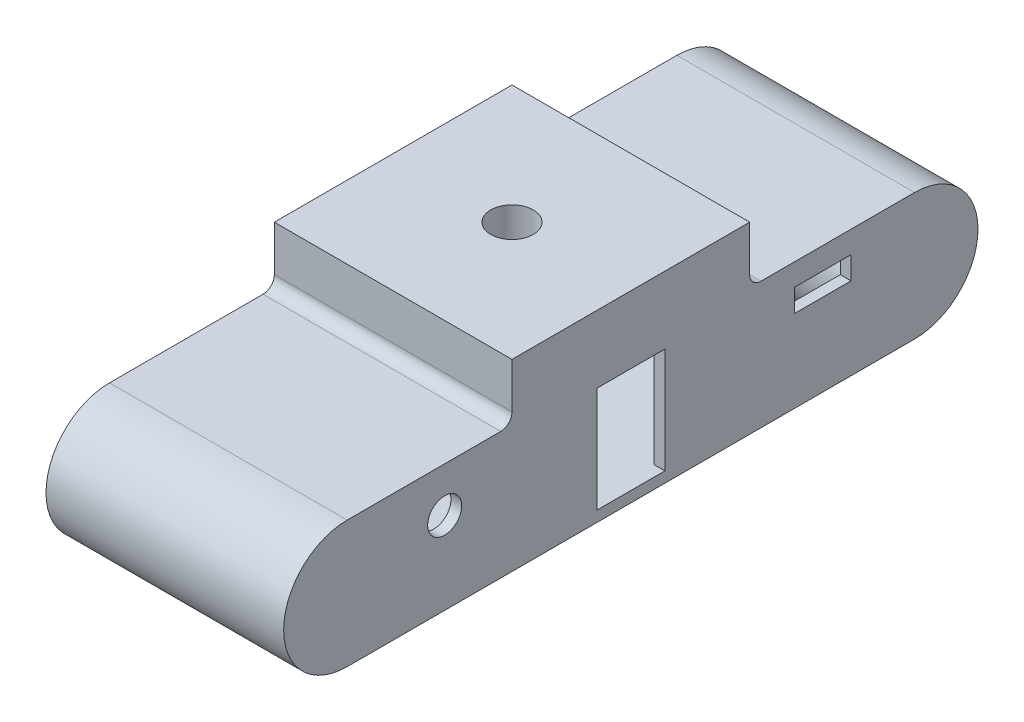
from build123d import *

# Parameters (mm, degrees)
SKETCH1_R               = 11.811
BOSS_EXTRUDE1_DEPTH     = 50.8
BOSS_EXTRUDE2_DEPTH     = 2.399999772
SKETCH5_R               = 3.81
SKETCH5_W               = 12.7
SKETCH5_H               = 5.08
SKETCH5_W_2             = 15.24
SKETCH5_H_2             = 23.622
CUT_EXTRUDE3_DEPTH      = 3.81
SKETCH8_W               = 53.199999772
SKETCH8_H               = 53.199999772
BOSS_EXTRUDE3_DEPTH     = 12.7
CUT_EXTRUDE5_DEPTH      = 99.371995605
CUT_EXTRUDE5_DEPTH_BACK = 3.81
SKETCH6_R               = 4.7625
FILLET1_R               = 2.54


with BuildPart() as part:
    # Sketch1 → Boss-Extrude1 (new body)
    with BuildSketch(Plane(origin=(0, 0, 0), x_dir=(0, 0, -1), z_dir=(1, 0, 0))):
        with BuildLine():
            Line((-63.5, 14.210999772), (63.5, 14.210999772))
            ThreePointArc((63.5, 14.210999772), (77.710999772, 0), (63.5, -14.210999772))
            Line((63.5, -14.210999772), (-63.5, -14.210999772))
            ThreePointArc((-63.5, -14.210999772), (-77.710999772, 0), (-63.5, 14.210999772))
        make_face()
        with Locations((-63.5, 0)):
            Circle(SKETCH1_R, mode=Mode.SUBTRACT)
        with Locations((63.5, 0)):
            Circle(SKETCH1_R, mode=Mode.SUBTRACT)
        with BuildLine():
            Line((-55.597292014, 11.811), (55.597292014, 11.811))
            ThreePointArc((55.597292014, 11.811), (49.289000228, 0), (55.597292014, -11.811))
            Line((55.597292014, -11.811), (-55.597292014, -11.811))
            ThreePointArc((-55.597292014, -11.811), (-49.289000228, 0), (-55.597292014, 11.811))
        make_face(mode=Mode.SUBTRACT)
    extrude(amount=BOSS_EXTRUDE1_DEPTH)

    # Sketch2 → Boss-Extrude2 (add)
    with BuildSketch(Plane(origin=(50.8, 0, 0), x_dir=(0, 0, -1), z_dir=(1, 0, 0))):
        with BuildLine():
            Line((-63.5, -14.210999772), (63.5, -14.210999772))
            ThreePointArc((63.5, -14.210999772), (77.710999772, 0), (63.5, 14.210999772))
            Line((63.5, 14.210999772), (-63.5, 14.210999772))
            ThreePointArc((-63.5, 14.210999772), (-77.710999772, 0), (-63.5, -14.210999772))
        make_face()
    extrude(amount=BOSS_EXTRUDE2_DEPTH)

    # Sketch5 → Cut-Extrude3 (cut)
    with BuildSketch(Plane.ZY.offset(-50.8)):
        with Locations((41.669000228, 4.191)):
            Circle(SKETCH5_R)
        with Locations((-42.939000228, 6.731)):
            Rectangle(SKETCH5_W, SKETCH5_H)
        Rectangle(SKETCH5_W_2, SKETCH5_H_2)
    extrude(amount=-CUT_EXTRUDE3_DEPTH, mode=Mode.SUBTRACT)

    # Sketch8 → Boss-Extrude3 (add)
    with BuildSketch(Plane(origin=(0, 14.210999772, 0), x_dir=(1, 0, 0), z_dir=(0, 1, 0))):
        with Locations((26.599999886, 0)):
            Rectangle(SKETCH8_W, SKETCH8_H)
    extrude(amount=BOSS_EXTRUDE3_DEPTH)

    # Sketch6 → Cut-Extrude5 (cut, two sides: drawn at the far end of the back side and taken through both)
    with BuildSketch(Plane(origin=(0, 14.210999772, 0), x_dir=(1, 0, 0), z_dir=(0, 1, 0)).offset(-CUT_EXTRUDE5_DEPTH_BACK)):
        with Locations(Location((26.599999886, 0, 0), (0, 0, 270))):
            Circle(SKETCH6_R)
    extrude(amount=CUT_EXTRUDE5_DEPTH + CUT_EXTRUDE5_DEPTH_BACK, mode=Mode.SUBTRACT)

    # Fillet1
    fillet1_edges = [part.edges().sort_by_distance(p)[0] for p in [
        (26.599999886, 14.210999772, 26.599999886),
        (26.599999886, 14.210999772, -26.599999886),
    ]]
    fillet(fillet1_edges, radius=FILLET1_R)


solid = part.part
